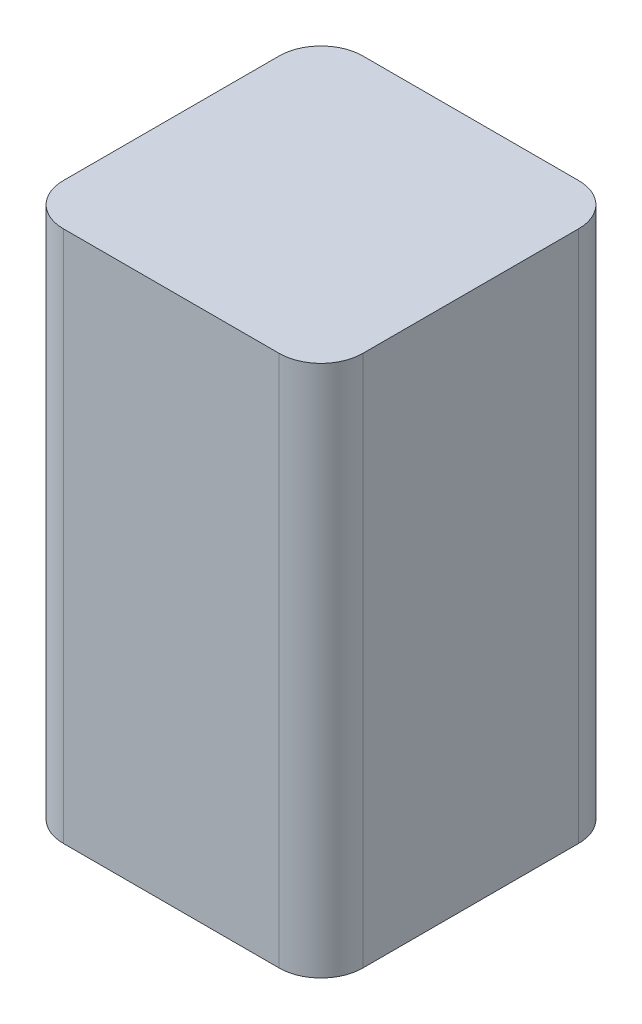
from build123d import *

# Parameters (mm, degrees)
SKETCH1_W           = 10
SKETCH1_H           = 10
BOSS_EXTRUDE1_DEPTH = 8.89
SKETCH2_R           = 2.5
CUT_EXTRUDE1_DEPTH  = 11.43
FILLET1_R           = 1.397


with BuildPart() as part:
    # Sketch1 → Boss-Extrude1 (new, symmetric)
    with BuildSketch(Plane(origin=(0, 0, 0), x_dir=(1, 0, 0), z_dir=(0, 1, 0))):
        Rectangle(SKETCH1_W, SKETCH1_H)
    extrude(amount=BOSS_EXTRUDE1_DEPTH, both=True)

    # Sketch2 → Cut-Extrude1 (cut)
    with BuildSketch(Plane.XZ.offset(8.89)):
        with Locations(Location((0, 0, 0), (0, 0, 270))):
            Circle(SKETCH2_R)
    extrude(amount=-CUT_EXTRUDE1_DEPTH, mode=Mode.SUBTRACT)

    # Fillet1
    fillet1_edges = [part.edges().sort_by_distance(p)[0] for p in [
        (5, 0, -5),
        (5, 0, 5),
        (-5, 0, 5),
        (-5, 0, -5),
    ]]
    fillet(fillet1_edges, radius=FILLET1_R)


solid = part.part
